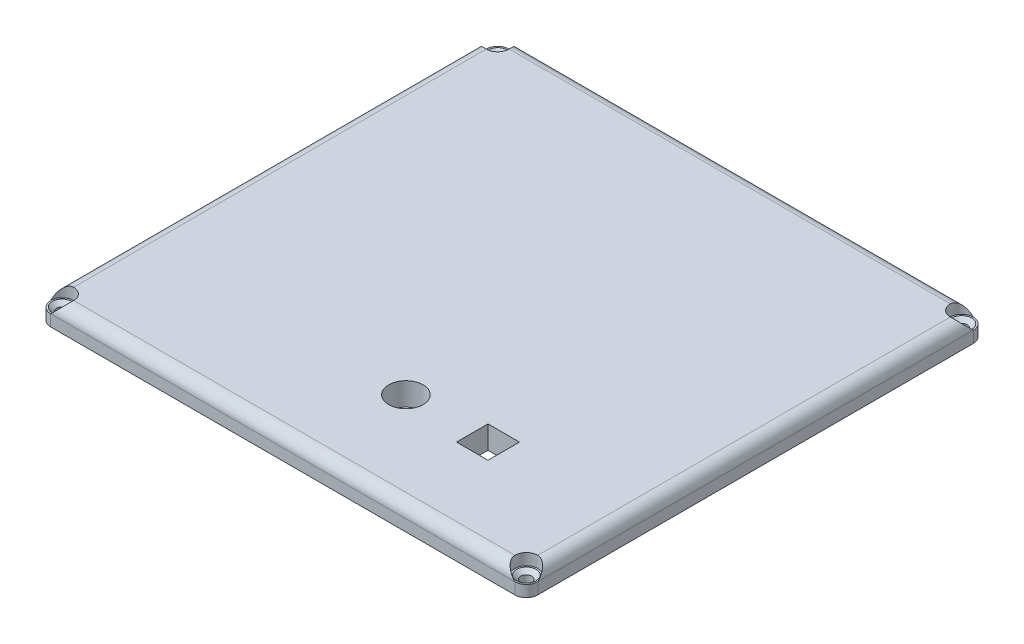
from build123d import *

# Parameters (mm, degrees)
SKETCH1_W                                         = 107.95
SKETCH1_H                                         = 101.6
BOSS_EXTRUDE1_DEPTH                               = 5.08
FILLET1_R                                         = 2.54
SKETCH2_W                                         = 98.425
SKETCH2_H                                         = 92.075
SKETCH2_W_2                                       = 92.994655172
SKETCH2_H_2                                       = 86.995
BOSS_EXTRUDE2_DEPTH                               = 2.54
SKETCH3_R                                         = 3.81
CUT_EXTRUDE1_DEPTH                                = 5.08
SKETCH4_W                                         = 6.985
SKETCH4_H                                         = 6.985
CUT_EXTRUDE2_DEPTH                                = 5.08
SKETCH5_R                                         = 2.54
CUT_EXTRUDE3_DEPTH                                = 2.54
LPATTERN1_COUNT                                   = 2
LPATTERN1_PITCH                                   = 96.52
LPATTERN1_COUNT_DIR2                              = 2
LPATTERN1_PITCH_DIR2                              = 102.87
CSK_FOR_2_FLAT_HEAD_MACHINE_SCREW_100_D           = 2.4384
CSK_FOR_2_FLAT_HEAD_MACHINE_SCREW_100_CSINK_D     = 4.3688
CSK_FOR_2_FLAT_HEAD_MACHINE_SCREW_100_CSINK_ANGLE = 100


with BuildPart() as part:
    # Sketch1 → Boss-Extrude1 (new body)
    with BuildSketch(Plane(origin=(0, 0, 0), x_dir=(1, 0, 0), z_dir=(0, 1, 0))):
        Rectangle(SKETCH1_W, SKETCH1_H)
    extrude(amount=BOSS_EXTRUDE1_DEPTH)

    # Fillet1
    fillet1_edges = [part.edges().sort_by_distance(p)[0] for p in [
        (-53.975, 5.08, 0),
        (0, 5.08, 50.8),
        (53.975, 5.08, 0),
        (0, 5.08, -50.8),
        (53.975, 2.54, 50.8),
        (-53.975, 2.54, 50.8),
        (-53.975, 2.54, -50.8),
        (53.975, 2.54, -50.8),
    ]]
    fillet(fillet1_edges, radius=FILLET1_R)

    # Sketch2 → Boss-Extrude2 (add)
    with BuildSketch(Plane.XZ):
        Rectangle(SKETCH2_W, SKETCH2_H)
        Rectangle(SKETCH2_W_2, SKETCH2_H_2, mode=Mode.SUBTRACT)
    extrude(amount=BOSS_EXTRUDE2_DEPTH)

    # Sketch3 → Cut-Extrude1 (cut)
    with BuildSketch(Plane.XZ):
        with Locations(Location((6.008676456, 29.518648142, 0), (0, 0, 270))):
            Circle(SKETCH3_R)
    extrude(amount=-CUT_EXTRUDE1_DEPTH, mode=Mode.SUBTRACT)

    # Sketch4 → Cut-Extrude2 (cut)
    with BuildSketch(Plane.XZ):
        with Locations((24.193347407, 29.518339929)):
            Rectangle(SKETCH4_W, SKETCH4_H)
    extrude(amount=-CUT_EXTRUDE2_DEPTH, mode=Mode.SUBTRACT)

    # Sketch5 → Cut-Extrude3 (cut)
    with BuildSketch(Plane(origin=(0, 5.08, 0), x_dir=(1, 0, 0), z_dir=(0, 1, 0))):
        with Locations((-51.435, -48.26)):
            Circle(SKETCH5_R)
    cut_extrude3 = extrude(amount=-CUT_EXTRUDE3_DEPTH, mode=Mode.SUBTRACT)

    # LPattern1: Cut-Extrude3 2 × 2
    with Locations(*[(j * LPATTERN1_PITCH_DIR2, 0, -i * LPATTERN1_PITCH) for i in range(LPATTERN1_COUNT) for j in range(LPATTERN1_COUNT_DIR2) if (i, j) != (0, 0)]):
        add(cut_extrude3, mode=Mode.SUBTRACT)

    # CSK for #2 Flat Head Machine Screw (100)1 (through all)
    with Locations(Plane(origin=(0, 2.54, 0), x_dir=(1, 0, 0), z_dir=(0, 1, 0))):
        with Locations((51.435, -48.26), (-51.435, -48.26), (-51.435, 48.26), (51.435, 48.26)):
            CounterSinkHole(CSK_FOR_2_FLAT_HEAD_MACHINE_SCREW_100_D / 2, CSK_FOR_2_FLAT_HEAD_MACHINE_SCREW_100_CSINK_D / 2, counter_sink_angle=CSK_FOR_2_FLAT_HEAD_MACHINE_SCREW_100_CSINK_ANGLE)


solid = part.part
